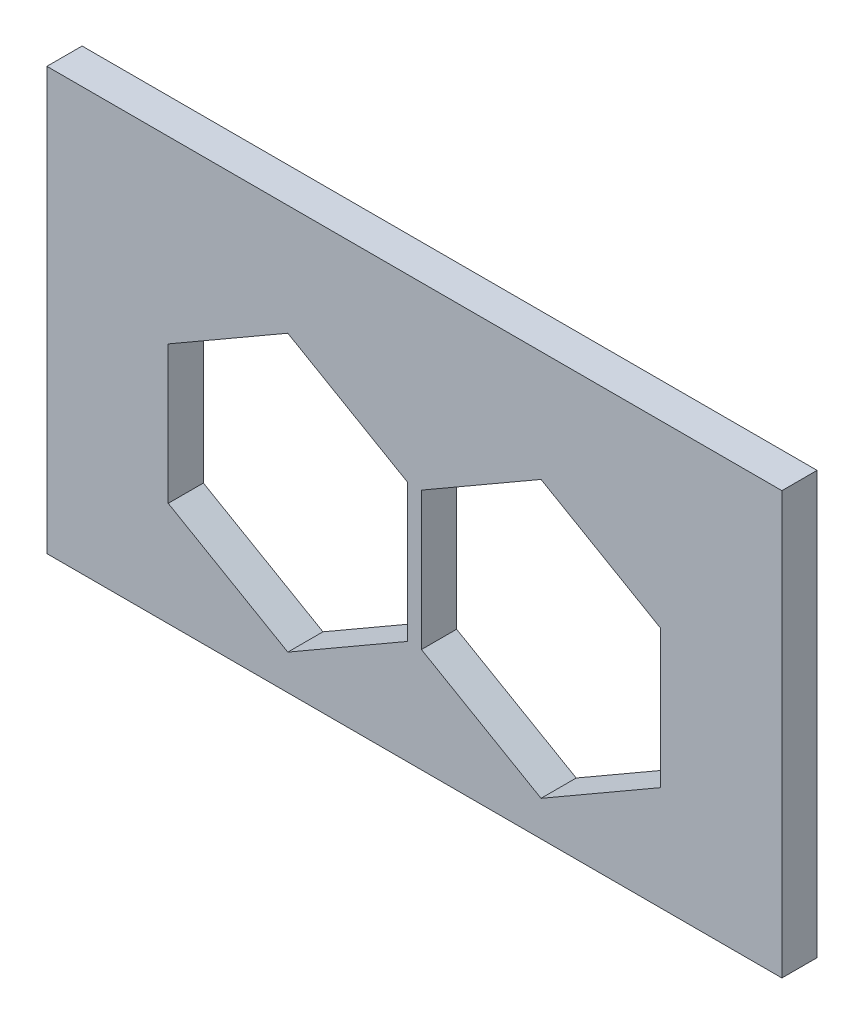
from build123d import *

# Parameters (mm, degrees)
SKETCH1_W           = 66.34988
SKETCH1_H           = 38.1
BOSS_EXTRUDE1_DEPTH = 3.175


with BuildPart() as part:
    # Sketch1 → Boss-Extrude1 (new body)
    with BuildSketch(Plane.XY):
        Rectangle(SKETCH1_W, SKETCH1_H)
        Polygon((11.43, -15.875), (22.225000466, -9.642503575), (22.225000466, 2.822489275), (11.43, 9.0549857), (0.634999534, 2.822489275), (0.634999534, -9.642503575), align=None, mode=Mode.SUBTRACT)
        Polygon((-0.634999534, -9.642503575), (-11.43, -15.875), (-22.225000466, -9.642503575), (-22.225000466, 2.822489275), (-11.43, 9.0549857), (-0.634999534, 2.822489275), align=None, mode=Mode.SUBTRACT)
    extrude(amount=BOSS_EXTRUDE1_DEPTH)


solid = part.part
